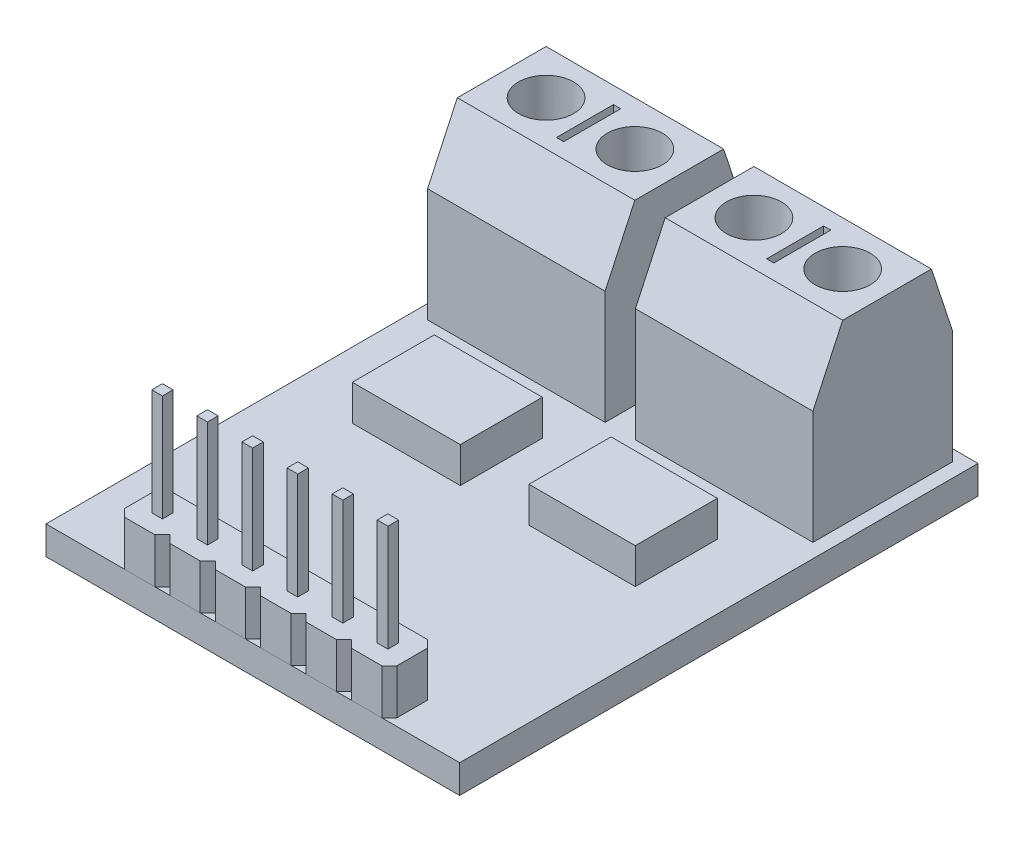
from build123d import *

# Parameters (mm, degrees)
SKETCH_1_W              = 23.3
SKETCH_1_H              = 29.2
EXTRUDE_1_DEPTH         = 1.6
EXTRUDE_2_DEPTH         = 2.54
SKETCH_3_W              = 0.6
SKETCH_3_H              = 0.6
EXTRUDE_3_DEPTH         = 6
PATTERN_LINEAR_11_COUNT = 6
PATTERN_LINEAR_11_PITCH = 2.54
SKETCH_4_W              = 6.084765078
SKETCH_4_H              = 4.622534711
SKETCH_4_W_2            = 5.990427635
EXTRUDE_4_DEPTH         = 2
SKETCH_5_W              = 10
SKETCH_5_H              = 7.86
EXTRUDE_5_DEPTH         = 10
CUT_EXTRUDE_1_DEPTH     = 28
SKETCH_7_W              = 4.089618495
SKETCH_7_H              = 5.460987571
CUT_EXTRUDE_2_DEPTH     = 6
SKETCH_8_R              = 1.55
SKETCH_8_W              = 0.408344746
SKETCH_8_H              = 3.212311997
CUT_EXTRUDE_3_DEPTH     = 6


with BuildPart() as part:
    # 草图1 → 凸台-拉伸1 (new body)
    with BuildSketch(Plane(origin=(0, 0, 0), x_dir=(1, 0, 0), z_dir=(0, 1, 0))):
        Rectangle(SKETCH_1_W, SKETCH_1_H)
    extrude(amount=EXTRUDE_1_DEPTH)

    # 草图2 → 凸台-拉伸2 (add)
    with BuildSketch(Plane(origin=(0, 1.6, 0), x_dir=(1, 0, 0), z_dir=(0, 1, 0))):
        Polygon((-4.668338696, -12.037397235), (-2.959469598, -12.037397235), (-2.535205529, -12.461661304), (-2.110941461, -12.037397235), (-0.402072363, -12.037397235), (0.022191706, -12.461661304), (0.446455775, -12.037397235), (2.155324873, -12.037397235), (2.579588942, -12.461661304), (3.00385301, -12.037397235), (4.712722108, -12.037397235), (5.136986177, -12.461661304), (5.561250246, -12.037397235), (7.270119344, -12.037397235), (7.694383412, -12.461661304), (7.694383412, -14.178338696), (7.270119344, -14.602602765), (5.561250246, -14.602602765), (5.136986177, -14.178338696), (4.712722108, -14.602602765), (3.00385301, -14.602602765), (2.579588942, -14.178338696), (2.155324873, -14.602602765), (0.446455775, -14.602602765), (0.022191706, -14.178338696), (-0.402072363, -14.602602765), (-2.110941461, -14.602602765), (-2.535205529, -14.178338696), (-2.959469598, -14.602602765), (-4.668338696, -14.602602765), (-5.092602765, -14.178338696), (-5.516866833, -14.602602765), (-7.225735931, -14.602602765), (-7.65, -14.178338696), (-7.65, -12.461661304), (-7.225735931, -12.037397235), (-5.516866833, -12.037397235), (-5.092602765, -12.461661304), align=None)
    extrude(amount=EXTRUDE_2_DEPTH)

    # 草图3 → 凸台-拉伸3 (add)
    with BuildSketch(Plane(origin=(0, 4.14, 0), x_dir=(1, 0, 0), z_dir=(0, 1, 0))):
        with Locations((-6.371301382, -13.32)):
            Rectangle(SKETCH_3_W, SKETCH_3_H)
    extrude_3 = extrude(amount=EXTRUDE_3_DEPTH)

    # 阵列(线性)11: 凸台-拉伸3 ×6
    with Locations(*[(i * PATTERN_LINEAR_11_PITCH, 0, 0) for i in range(1, PATTERN_LINEAR_11_COUNT)]):
        add(extrude_3)

    # 草图4 → 凸台-拉伸4 (add)
    with BuildSketch(Plane(origin=(0, 1.6, 0), x_dir=(1, 0, 0), z_dir=(0, 1, 0))):
        with Locations((-4.891303326, 1.247938362)):
            Rectangle(SKETCH_4_W, SKETCH_4_H)
        with Locations((5.014128197, 1.247938362)):
            Rectangle(SKETCH_4_W_2, SKETCH_4_H)
    extrude(amount=EXTRUDE_4_DEPTH)

    # 草图5 → 凸台-拉伸5 (add)
    with BuildSketch(Plane(origin=(0, 1.6, 0), x_dir=(1, 0, 0), z_dir=(0, 1, 0))):
        with Locations((-5.85390251, 10.028478066)):
            Rectangle(SKETCH_5_W, SKETCH_5_H)
        with Locations((5.85390251, 10.028478066)):
            Rectangle(SKETCH_5_W, SKETCH_5_H)
    extrude(amount=EXTRUDE_5_DEPTH)

    # 草图6 → 切除-拉伸1 (cut)
    with BuildSketch(Plane.ZY.offset(10.85390251)):
        Polygon((-13.958478066, 8), (-12.773407339, 11.6), (-7.773407339, 11.6), (-6.098478066, 8), (-4.60674586, 8), (-4.60674586, 12.734862091), (-15.29251654, 12.734862091), (-15.29251654, 8), align=None)
    extrude(amount=-CUT_EXTRUDE_1_DEPTH, mode=Mode.SUBTRACT)

    # 草图7 → 切除-拉伸2 (cut)
    with BuildSketch(Plane(origin=(0, 0, -13.958478066), x_dir=(-1, 0, 0), z_dir=(0, 0, -1))):
        with Locations((-8.248950011, 4.75004571)):
            Rectangle(SKETCH_7_W, SKETCH_7_H)
        with Locations((8.248950011, 4.75004571)):
            Rectangle(SKETCH_7_W, SKETCH_7_H)
        with Locations((3.473646978, 4.75004571)):
            Rectangle(SKETCH_7_W, SKETCH_7_H)
        with Locations((-3.473646978, 4.75004571)):
            Rectangle(SKETCH_7_W, SKETCH_7_H)
    extrude(amount=-CUT_EXTRUDE_2_DEPTH, mode=Mode.SUBTRACT)

    # 草图8 → 切除-拉伸3 (cut)
    with BuildSketch(Plane(origin=(0, 11.6, 0), x_dir=(1, 0, 0), z_dir=(0, 1, 0))):
        with Locations(Location((-8.35390251, 10.273407339, 0), (0, 0, 270))):
            Circle(SKETCH_8_R)
        with Locations(Location((-3.35390251, 10.273407339, 0), (0, 0, 270))):
            Circle(SKETCH_8_R)
        with Locations(Location((8.35390251, 10.273407339, 0), (0, 0, 180))):
            Circle(SKETCH_8_R)
        with Locations(Location((3.35390251, 10.273407339, 0), (0, 0, 180))):
            Circle(SKETCH_8_R)
        with Locations((-5.919084565, 10.231849543)):
            Rectangle(SKETCH_8_W, SKETCH_8_H)
        with Locations((5.919084565, 10.231849543)):
            Rectangle(SKETCH_8_W, SKETCH_8_H)
    extrude(amount=-CUT_EXTRUDE_3_DEPTH, mode=Mode.SUBTRACT)


solid = part.part
